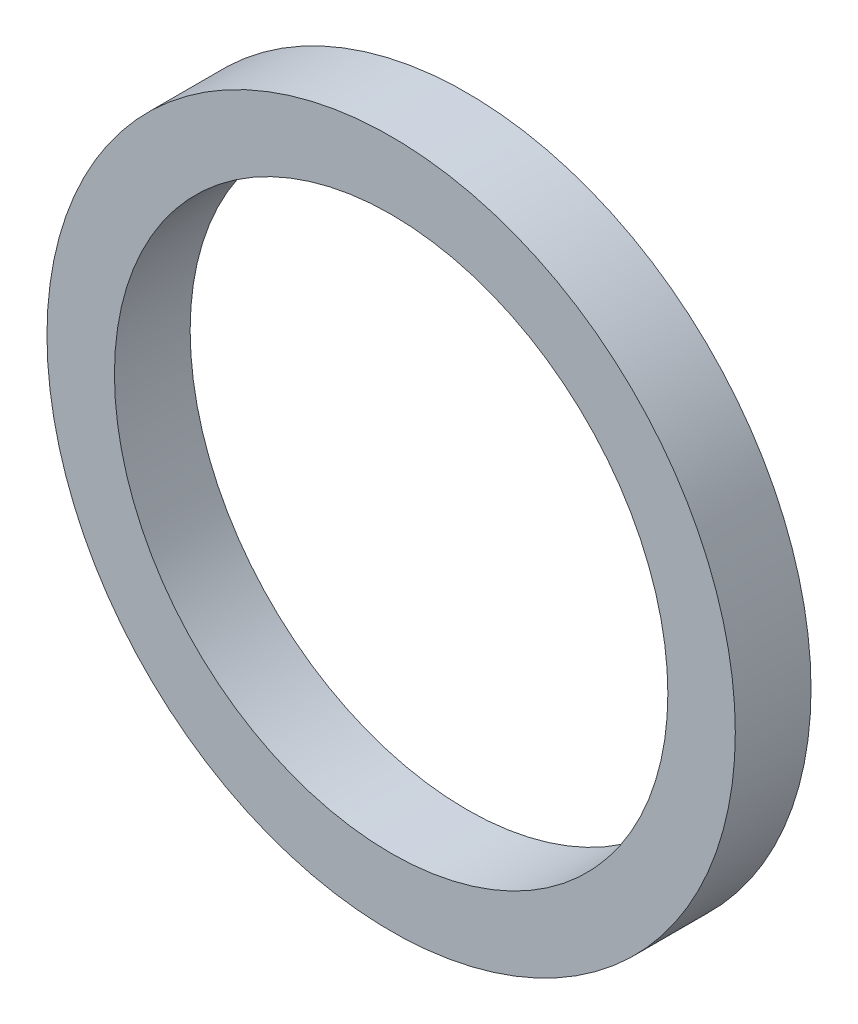
from build123d import *

# Parameters (mm, degrees)
SKETCH_1_R      = 25
SKETCH_1_R_2    = 20.1
EXTRUDE_1_DEPTH = 5.5


with BuildPart() as part:
    # 草图1 → 凸台-拉伸1 (new body)
    with BuildSketch(Plane.XY):
        Circle(SKETCH_1_R)
        Circle(SKETCH_1_R_2, mode=Mode.SUBTRACT)
    extrude(amount=EXTRUDE_1_DEPTH)


solid = part.part
